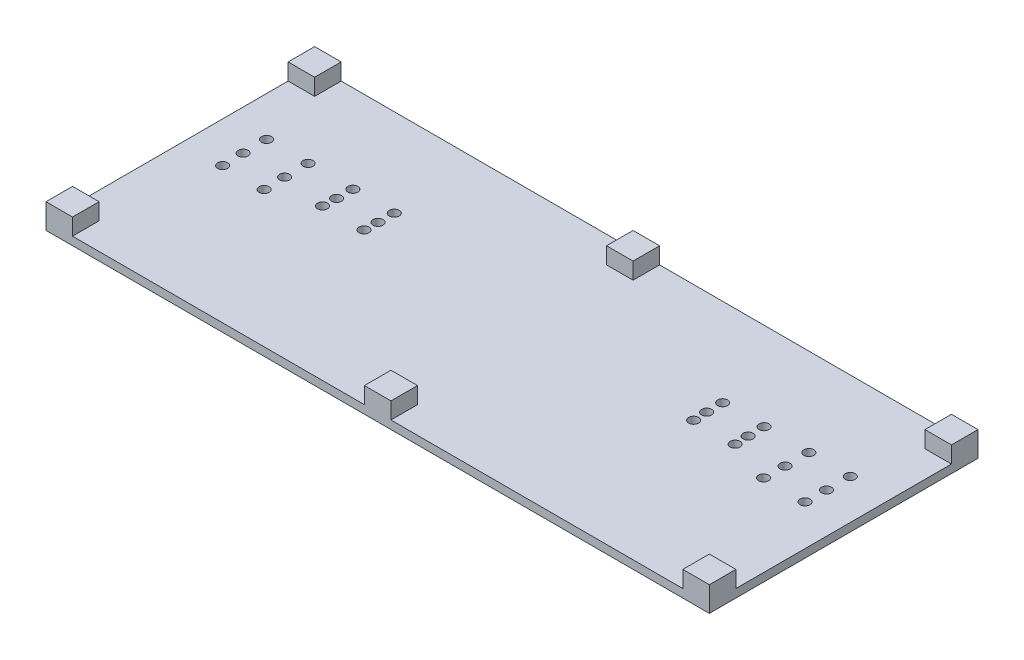
from build123d import *

# Parameters (mm, degrees)
SKETCH1_W           = 100
SKETCH1_H           = 81
BOSS_EXTRUDE1_DEPTH = 2.5
SKETCH3_R           = 1.5
CUT_EXTRUDE1_DEPTH  = 108.91895107
SKETCH4_W           = 8
SKETCH4_H           = 8
SKETCH4_W_2         = 4
BOSS_EXTRUDE2_DEPTH = 5


with BuildPart() as part:
    # Sketch1 → Boss-Extrude1 (new body)
    with BuildSketch(Plane(origin=(0, 0, 0), x_dir=(1, 0, 0), z_dir=(0, 1, 0))):
        with Locations((50, 0)):
            Rectangle(SKETCH1_W, SKETCH1_H)
    boss_extrude1 = extrude(amount=-BOSS_EXTRUDE1_DEPTH)

    # Sketch3 → Cut-Extrude1 (cut, through all)
    with BuildSketch(Plane(origin=(0, 0, 0), x_dir=(1, 0, 0), z_dir=(0, 1, 0))):
        with Locations(Location((88, 14, 0), (0, 0, 270))):
            Circle(SKETCH3_R)
        with Locations(Location((62, 14, 0), (0, 0, 90))):
            Circle(SKETCH3_R)
        with Locations(Location((62.049468925, 9.152599975, 0), (0, 0, 270))):
            Circle(SKETCH3_R)
        with Locations(Location((87.950531075, 6.886550664, 0), (0, 0, 270))):
            Circle(SKETCH3_R)
        with Locations(Location((62.197499211, 5.073814511, 0), (0, 0, 270))):
            Circle(SKETCH3_R)
        with Locations(Location((87.802500789, 0.558961892, 0), (0, 0, 270))):
            Circle(SKETCH3_R)
        with Locations(Location((49.5, 14, 0), (0, 0, 270))):
            Circle(SKETCH3_R)
        with Locations(Location((75.5, 14, 0), (0, 0, 270))):
            Circle(SKETCH3_R)
        with Locations(Location((49.549468925, 9.152599975, 0), (0, 0, 270))):
            Circle(SKETCH3_R)
        with Locations(Location((75.450531075, 6.886550664, 0), (0, 0, 270))):
            Circle(SKETCH3_R)
        with Locations(Location((49.697499211, 5.073814511, 0), (0, 0, 270))):
            Circle(SKETCH3_R)
        with Locations(Location((75.302500789, 0.558961892, 0), (0, 0, 270))):
            Circle(SKETCH3_R)
    cut_extrude1 = extrude(amount=-CUT_EXTRUDE1_DEPTH, mode=Mode.SUBTRACT)

    # Sketch4 → Boss-Extrude2 (add)
    with BuildSketch(Plane(origin=(0, 0, 0), x_dir=(1, 0, 0), z_dir=(0, 1, 0))):
        with Locations((96, -36.5)):
            Rectangle(SKETCH4_W, SKETCH4_H)
        with Locations((96, 36.5)):
            Rectangle(SKETCH4_W, SKETCH4_H)
        with Locations((2, -36.5)):
            Rectangle(SKETCH4_W_2, SKETCH4_H)
        with Locations((2, 36.5)):
            Rectangle(SKETCH4_W_2, SKETCH4_H)
    boss_extrude2 = extrude(amount=BOSS_EXTRUDE2_DEPTH)

    # Mirror1: Boss-Extrude1, Cut-Extrude1, Boss-Extrude2 across plane
    add(boss_extrude1.mirror(Plane(origin=(0, 0, 0), x_dir=(0, 0, 1), z_dir=(1, 0, 0))))
    add(cut_extrude1.mirror(Plane(origin=(0, 0, 0), x_dir=(0, 0, 1), z_dir=(1, 0, 0))), mode=Mode.SUBTRACT)
    add(boss_extrude2.mirror(Plane(origin=(0, 0, 0), x_dir=(0, 0, 1), z_dir=(1, 0, 0))))


solid = part.part
